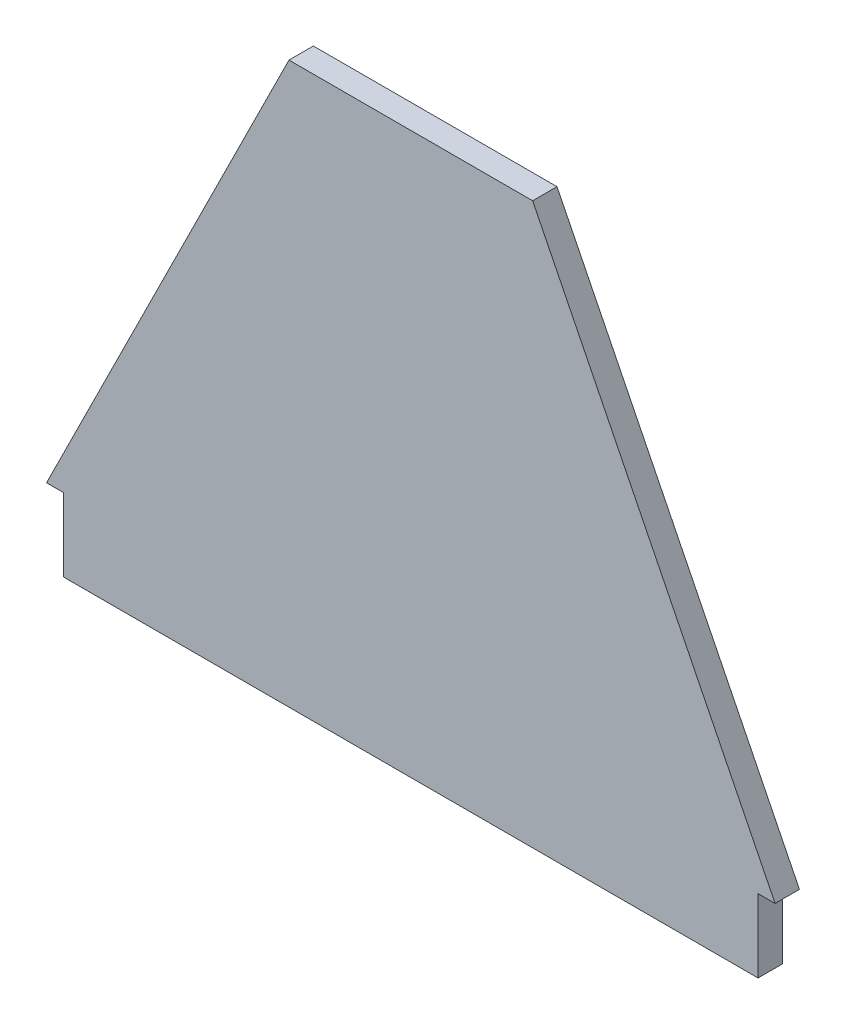
from build123d import *

# Parameters (mm, degrees)
BOSS_EXTRUDE1_DEPTH = 5


with BuildPart() as part:
    # Sketch1 → Boss-Extrude1 (new body)
    with BuildSketch(Plane.XY):
        Polygon((74.75, 15), (71.25, 15), (71.25, 0), (-71.25, 0), (-71.25, 15), (-74.75, 15), (-25, 115), (25, 115), align=None)
    extrude(amount=BOSS_EXTRUDE1_DEPTH)


solid = part.part
